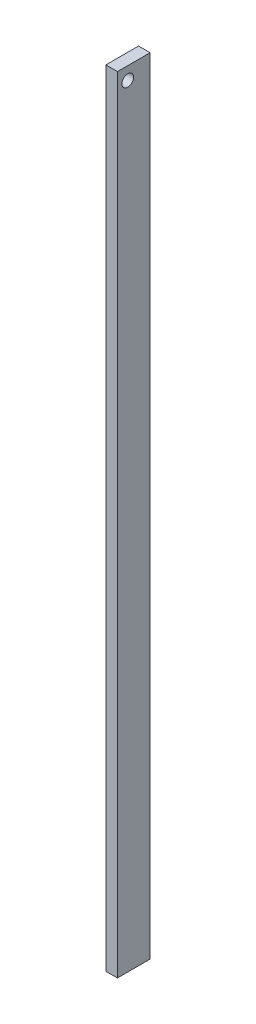
from build123d import *

# Parameters (mm, degrees)
SKETCH1_W           = 4.5
SKETCH1_H           = 12.7
BOSS_EXTRUDE1_DEPTH = 304.8
SKETCH3_R           = 2.25
CUT_EXTRUDE1_DEPTH  = 306.097656497


with BuildPart() as part:
    # Sketch1 → Boss-Extrude1 (new body)
    with BuildSketch(Plane(origin=(0, 0, 0), x_dir=(1, 0, 0), z_dir=(0, 1, 0))):
        with Locations((2.25, 6.35)):
            Rectangle(SKETCH1_W, SKETCH1_H)
    extrude(amount=BOSS_EXTRUDE1_DEPTH)

    # Sketch3 → Cut-Extrude1 (cut, through all)
    with BuildSketch(Plane.ZY):
        with Locations((-4, 299.8)):
            Circle(SKETCH3_R)
    extrude(amount=-CUT_EXTRUDE1_DEPTH, mode=Mode.SUBTRACT)


solid = part.part
